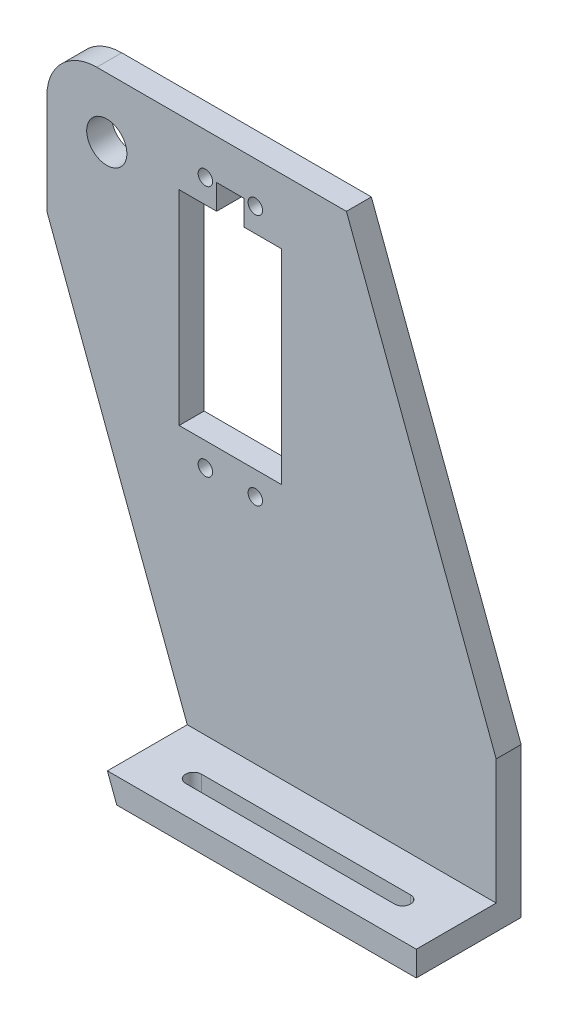
from build123d import *

# Parameters (mm, degrees)
SKETCH2_W           = 90
SKETCH2_H           = 5
BOSS_EXTRUDE1_DEPTH = 21
SKETCH3_W           = 90
SKETCH3_H           = 5
BOSS_EXTRUDE2_DEPTH = 105
FILLET1_R           = 10
SKETCH4_R           = 4.025
CUT_EXTRUDE1_DEPTH  = 118.631840928
CUT_EXTRUDE2_DEPTH  = 119.415581745
SKETCH7_R           = 1.45
CUT_EXTRUDE4_DEPTH  = 5
SKETCH6_W           = 5.5
SKETCH6_H           = 5
SKETCH6_W_2         = 20.5
SKETCH6_H_2         = 40.9
CUT_EXTRUDE3_DEPTH  = 118.631840928
CUT_EXTRUDE5_DEPTH  = 10


with BuildPart() as part:
    # Sketch2 → Boss-Extrude1 (new body)
    with BuildSketch(Plane.XY):
        Rectangle(SKETCH2_W, SKETCH2_H)
    extrude(amount=BOSS_EXTRUDE1_DEPTH)

    # Sketch3 → Boss-Extrude2 (add)
    with BuildSketch(Plane(origin=(0, 2.5, 0), x_dir=(1, 0, 0), z_dir=(0, 1, 0))):
        with Locations((0, -2.5)):
            Rectangle(SKETCH3_W, SKETCH3_H)
    extrude(amount=BOSS_EXTRUDE2_DEPTH)

    # Fillet1
    fillet1_edges = [part.edges().sort_by_distance(p)[0] for p in [
        (-45, 107.5, 2.5),
    ]]
    fillet(fillet1_edges, radius=FILLET1_R)

    # Sketch4 → Cut-Extrude1 (cut, through all)
    with BuildSketch(Plane.XY.offset(5)):
        with Locations((-33, 95.5)):
            Circle(SKETCH4_R)
    extrude(amount=-CUT_EXTRUDE1_DEPTH, mode=Mode.SUBTRACT)

    # Sketch5 → Cut-Extrude2 (cut, through all)
    with BuildSketch(Plane.XY.offset(21)):
        Polygon((-45, 77.5), (-15, -2.5), (-45, -2.5), align=None)
        Polygon((15, 107.5), (45, 27.5), (45, 107.5), align=None)
    extrude(amount=-CUT_EXTRUDE2_DEPTH, mode=Mode.SUBTRACT)

    # Sketch7 → Cut-Extrude4 (cut)
    with BuildSketch(Plane.XY.offset(5)):
        with Locations((-13.25, 48.85)):
            Circle(SKETCH7_R)
        with Locations((-3.25, 48.85)):
            Circle(SKETCH7_R)
        with Locations((-3.25, 99.25)):
            Circle(SKETCH7_R)
        with Locations((-13.25, 99.25)):
            Circle(SKETCH7_R)
    extrude(amount=-CUT_EXTRUDE4_DEPTH, mode=Mode.SUBTRACT)

    # Sketch6 → Cut-Extrude3 (cut, through all)
    with BuildSketch(Plane.XY.offset(5)):
        with Locations((-8.25, 97)):
            Rectangle(SKETCH6_W, SKETCH6_H)
        with Locations((-8.25, 74.05)):
            Rectangle(SKETCH6_W_2, SKETCH6_H_2)
    extrude(amount=-CUT_EXTRUDE3_DEPTH, mode=Mode.SUBTRACT)

    # Sketch8 → Cut-Extrude5 (cut)
    with BuildSketch(Plane(origin=(0, 2.5, 0), x_dir=(1, 0, 0), z_dir=(0, 1, 0))):
        with BuildLine():
            Line((-6.875, -12.15), (35, -12.15))
            ThreePointArc((35, -12.15), (36.6, -13.75), (35, -15.35))
            Line((35, -15.35), (-6.875, -15.35))
            ThreePointArc((-6.875, -15.35), (-8.475, -13.75), (-6.875, -12.15))
        make_face()
    extrude(amount=-CUT_EXTRUDE5_DEPTH, mode=Mode.SUBTRACT)


solid = part.part
